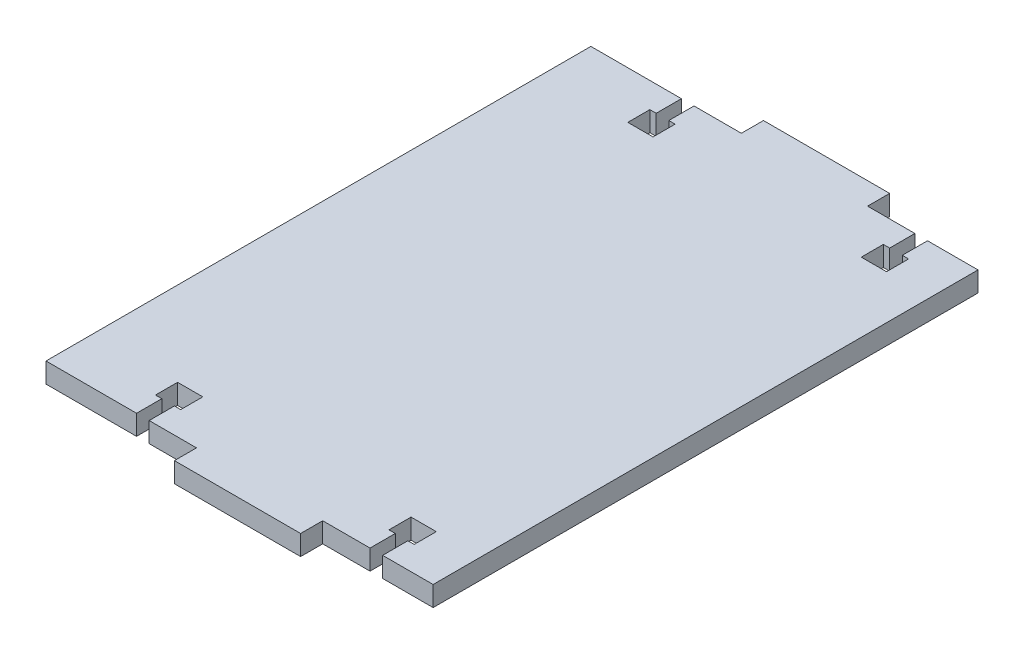
from build123d import *

# Parameters (mm, degrees)
SKETCH1_W            = 61.35
SKETCH1_H            = 86.35
BOSS_EXTRUDE1_DEPTH  = 3.175
SKETCH2_W            = 20
SKETCH2_H            = 3.5
BOSS_EXTRUDE2_DEPTH  = 3.175
CUT_EXTRUDE1_DEPTH   = 3.175
MIRROR2_COPY_1_DEPTH = 3.175


with BuildPart() as part:
    # Sketch1 → Boss-Extrude1 (new body)
    with BuildSketch(Plane(origin=(0, 0, 0), x_dir=(1, 0, 0), z_dir=(0, 1, 0))):
        with Locations((30.675, 43.175)):
            Rectangle(SKETCH1_W, SKETCH1_H)
    extrude(amount=BOSS_EXTRUDE1_DEPTH)

    # Sketch2 → Boss-Extrude2 (add)
    with BuildSketch(Plane.XZ):
        with Locations((33.85, 1.75)):
            Rectangle(SKETCH2_W, SKETCH2_H)
    boss_extrude2 = extrude(amount=-BOSS_EXTRUDE2_DEPTH)

    # Sketch3 → Cut-Extrude1 (cut)
    with BuildSketch(Plane(origin=(0, 3.175, 0), x_dir=(1, 0, 0), z_dir=(0, 1, 0))):
        Polygon((16.35, 0), (16.35, 4), (17.35, 4), (17.35, 7.5), (13.35, 7.5), (13.35, 4), (14.35, 4), (14.35, 0), align=None)
    cut_extrude1 = extrude(amount=-CUT_EXTRUDE1_DEPTH, mode=Mode.SUBTRACT)

    # Mirror1: Cut-Extrude1 across plane
    add(cut_extrude1.mirror(Plane(origin=(33.85, 0, 0), x_dir=(0, 0, 1), z_dir=(1, 0, 0))), mode=Mode.SUBTRACT)

    # Mirror2: Boss-Extrude2, Cut-Extrude1 across plane
    add(boss_extrude2.mirror(Plane.XY.offset(-43.175)))
    add(cut_extrude1.mirror(Plane.XY.offset(-43.175)), mode=Mode.SUBTRACT)

    # Mirror2 copy 1 sketch → Mirror2 copy 1 (cut)
    with BuildSketch(Plane(origin=(67.7, 3.175, -86.35), x_dir=(-1, 0, 0), z_dir=(0, 1, 0))):
        Polygon((16.35, 0), (16.35, 4), (17.35, 4), (17.35, 7.5), (13.35, 7.5), (13.35, 4), (14.35, 4), (14.35, 0), align=None)
    extrude(amount=-MIRROR2_COPY_1_DEPTH, mode=Mode.SUBTRACT)


solid = part.part
